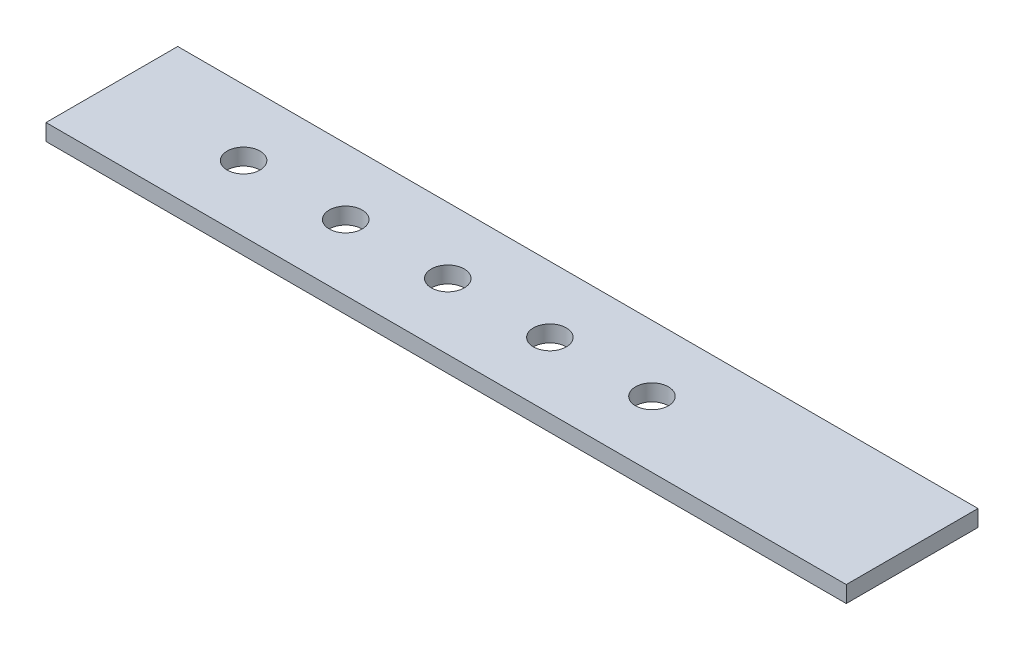
from build123d import *

# Parameters (mm, degrees)
SKETCH1_W           = 154.305
SKETCH1_H           = 25.4
SKETCH1_R           = 3.175
BOSS_EXTRUDE1_DEPTH = 3.175


with BuildPart() as part:
    # Sketch1 → Boss-Extrude1 (new body)
    with BuildSketch(Plane(origin=(0, 0, 0), x_dir=(1, 0, 0), z_dir=(0, 1, 0))):
        with Locations((-77.1525, 0)):
            Rectangle(SKETCH1_W, SKETCH1_H)
        with Locations(Location((-109.22, 0, 0), (0, 0, 270))):
            Circle(SKETCH1_R, mode=Mode.SUBTRACT)
        with Locations(Location((-89.535, 0, 0), (0, 0, 270))):
            Circle(SKETCH1_R, mode=Mode.SUBTRACT)
        with Locations(Location((-69.85, 0, 0), (0, 0, 270))):
            Circle(SKETCH1_R, mode=Mode.SUBTRACT)
        with Locations(Location((-128.905, 0, 0), (0, 0, 270))):
            Circle(SKETCH1_R, mode=Mode.SUBTRACT)
        with Locations(Location((-50.165, 0, 0), (0, 0, 270))):
            Circle(SKETCH1_R, mode=Mode.SUBTRACT)
    extrude(amount=BOSS_EXTRUDE1_DEPTH)


solid = part.part
